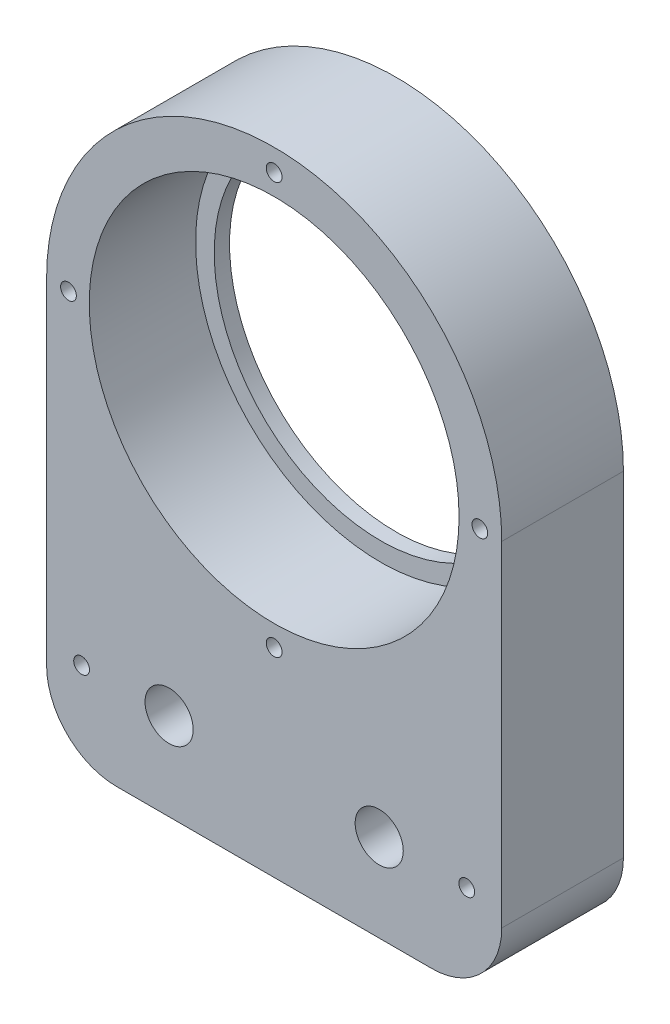
from build123d import *

# Parameters (mm, degrees)
SKETCH_2_R          = 19
SKETCH_2_R_2        = 2.75
EXTRUDE_1_DEPTH     = 13.9
SKETCH_3_R          = 21.125
CUT_EXTRUDE_1_DEPTH = 12.15
SKETCH_4_R          = 5
CUT_EXTRUDE_2_DEPTH = 3
FILLET_1_R          = 8
SKETCH_5_R          = 0.9
CUT_EXTRUDE_3_DEPTH = 60.993937194


with BuildPart() as part:
    # Эскиз2 → Бобышка-Вытянуть1 (new body)
    with BuildSketch(Plane.XY):
        with BuildLine():
            ThreePointArc((26, 26.25), (0, 52.25), (-26, 26.25))
            Line((-26, 26.25), (-26, -20))
            Line((-26, -20), (26, -20))
            Line((26, -20), (26, 26.25))
        make_face()
        with Locations((0, 26.25)):
            Circle(SKETCH_2_R, mode=Mode.SUBTRACT)
        with Locations((12, -10)):
            Circle(SKETCH_2_R_2, mode=Mode.SUBTRACT)
        with Locations((-12, -10)):
            Circle(SKETCH_2_R_2, mode=Mode.SUBTRACT)
    extrude(amount=EXTRUDE_1_DEPTH)

    # Эскиз3 → Вырез-Вытянуть1 (cut)
    with BuildSketch(Plane.XY.offset(13.9)):
        with Locations((0, 26.25)):
            Circle(SKETCH_3_R)
    extrude(amount=-CUT_EXTRUDE_1_DEPTH, mode=Mode.SUBTRACT)

    # Эскиз4 → Вырез-Вытянуть2 (cut)
    with BuildSketch(Plane(origin=(0, 0, 0), x_dir=(-1, 0, 0), z_dir=(0, 0, -1))):
        with Locations((-12, -10)):
            Circle(SKETCH_4_R)
        with Locations((12, -10)):
            Circle(SKETCH_4_R)
    extrude(amount=-CUT_EXTRUDE_2_DEPTH, mode=Mode.SUBTRACT)

    # Скругление1
    fillet_1_edges = [part.edges().sort_by_distance(p)[0] for p in [
        (26, -20, 6.95),
        (-26, -20, 6.95),
    ]]
    fillet(fillet_1_edges, radius=FILLET_1_R)

    # Эскиз5 → Вырез-Вытянуть3 (cut, through all)
    with BuildSketch(Plane.XY.offset(13.9)):
        with Locations((0, 49.75)):
            Circle(SKETCH_5_R)
        with Locations((-23.5, 26.25)):
            Circle(SKETCH_5_R)
        with Locations((0, 2.75)):
            Circle(SKETCH_5_R)
        with Locations((23.5, 26.25)):
            Circle(SKETCH_5_R)
        with Locations((-22, -10)):
            Circle(SKETCH_5_R)
        with Locations(Location((22, -10, 0), (0, 0, 180))):
            Circle(SKETCH_5_R)
    extrude(amount=-CUT_EXTRUDE_3_DEPTH, mode=Mode.SUBTRACT)


solid = part.part
